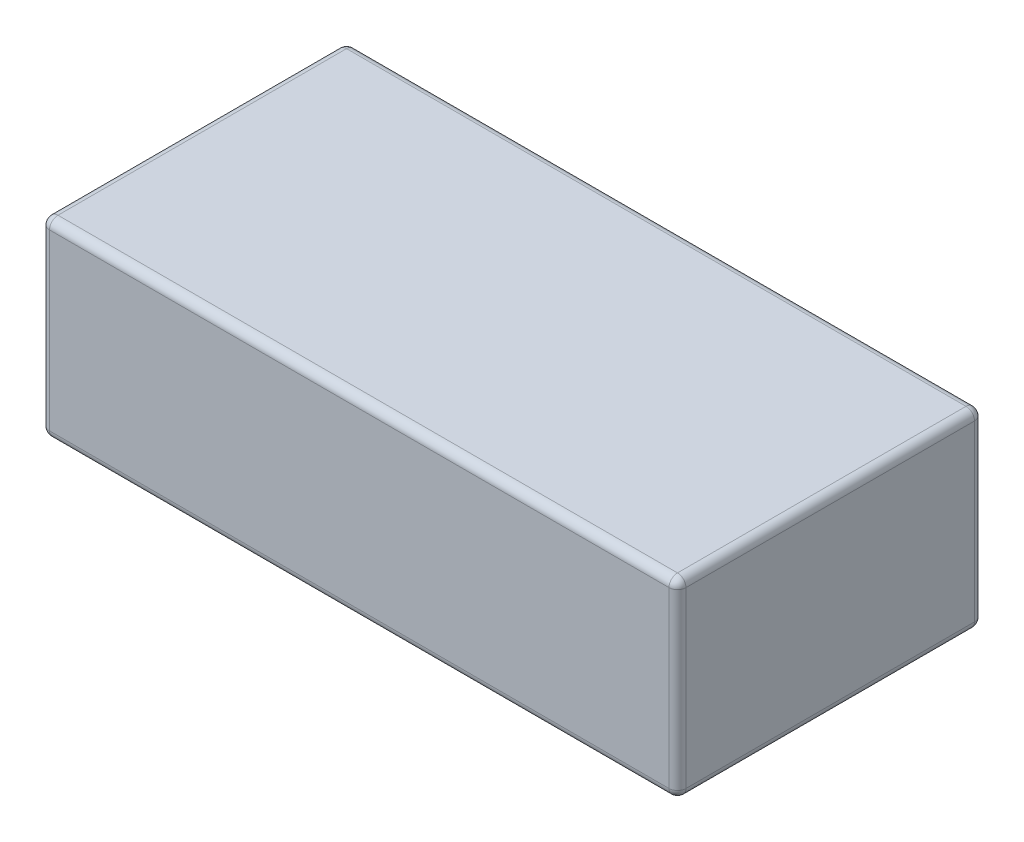
from build123d import *

# Parameters (mm, degrees)
SKETCH1_W           = 150
SKETCH1_H           = 72
BOSS_EXTRUDE1_DEPTH = 45
FILLET1_R           = 2


with BuildPart() as part:
    # Sketch1 → Boss-Extrude1 (new body)
    with BuildSketch(Plane(origin=(0, 0, 0), x_dir=(1, 0, 0), z_dir=(0, 1, 0))):
        Rectangle(SKETCH1_W, SKETCH1_H)
    extrude(amount=BOSS_EXTRUDE1_DEPTH)

    # Fillet1
    fillet1_edges = [part.edges().sort_by_distance(p)[0] for p in [
        (-75, 45, 0),
        (0, 45, 36),
        (75, 45, 0),
        (0, 0, 36),
        (-75, 0, 0),
        (0, 0, -36),
        (75, 0, 0),
        (0, 45, -36),
        (75, 22.5, 36),
        (-75, 22.5, 36),
        (-75, 22.5, -36),
        (75, 22.5, -36),
    ]]
    fillet(fillet1_edges, radius=FILLET1_R)


solid = part.part
